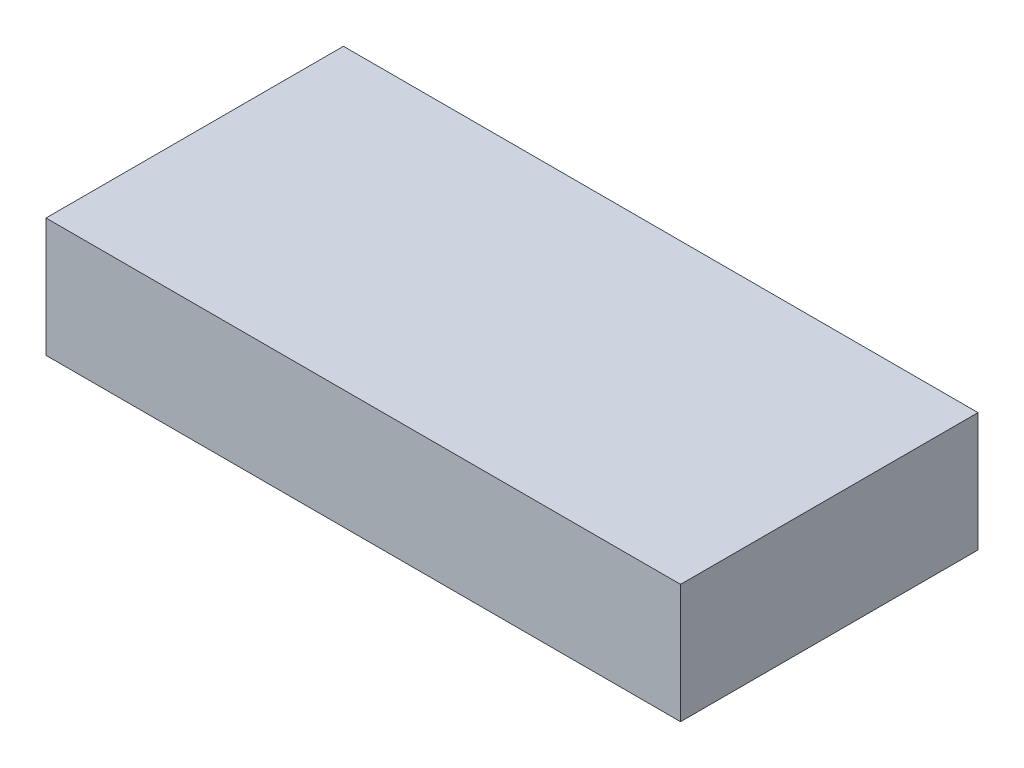
from build123d import *

# Parameters (mm, degrees)
SKETCH1_W           = 101.6
SKETCH1_H           = 19.05
BOSS_EXTRUDE1_DEPTH = 23.8125


with BuildPart() as part:
    # Sketch1 → Boss-Extrude1 (new, symmetric)
    with BuildSketch(Plane.XY):
        Rectangle(SKETCH1_W, SKETCH1_H)
    extrude(amount=BOSS_EXTRUDE1_DEPTH, both=True)


solid = part.part
